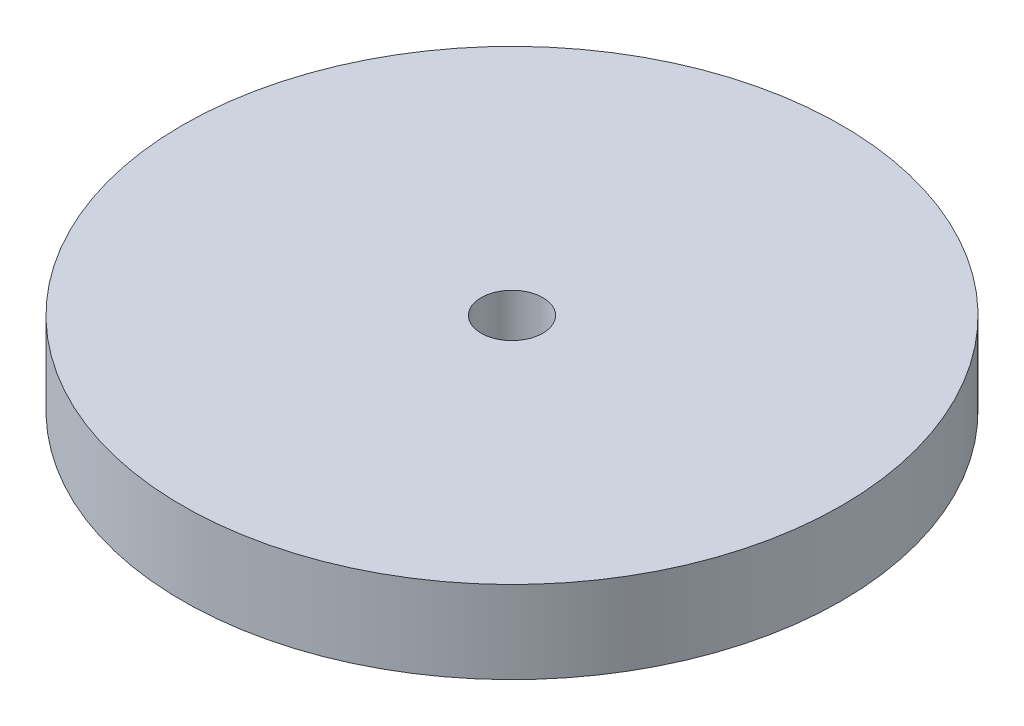
from build123d import *

# Parameters (mm, degrees)
SKETCH3_W           = 76.2
SKETCH3_H           = 9.525
BOSS_EXTRUDE1_DEPTH = 76.2
SKETCH4_R           = 3.5687
CUT_EXTRUDE2_DEPTH  = 86.725
CUT_EXTRUDE4_DEPTH  = 12.7
CUT_EXTRUDE6_DEPTH  = 12.7
CUT_EXTRUDE9_DEPTH  = 12.7
CUT_EXTRUDE10_DEPTH = 12.7


with BuildPart() as part:
    # Sketch3 → Boss-Extrude1 (new body)
    with BuildSketch(Plane.XY):
        Rectangle(SKETCH3_W, SKETCH3_H)
    extrude(amount=BOSS_EXTRUDE1_DEPTH)

    # Sketch4 → Cut-Extrude2 (cut, through all)
    with BuildSketch(Plane(origin=(0, 4.7625, 0), x_dir=(1, 0, 0), z_dir=(0, 1, 0))):
        with Locations(Location((0, -38.1, 0), (0, 0, 180))):
            Circle(SKETCH4_R)
    extrude(amount=-CUT_EXTRUDE2_DEPTH, mode=Mode.SUBTRACT)

    # Sketch5 → Cut-Extrude4 (cut)
    with BuildSketch(Plane(origin=(0, 4.7625, 0), x_dir=(1, 0, 0), z_dir=(0, 1, 0))):
        with BuildLine():
            Line((-38.1, -38.1), (-38.1, 0))
            Line((-38.1, 0), (0, 0))
            ThreePointArc((0, 0), (-26.940768363, -11.159231637), (-38.1, -38.1))
        make_face()
    extrude(amount=-CUT_EXTRUDE4_DEPTH, mode=Mode.SUBTRACT)

    # Sketch7 → Cut-Extrude6 (cut)
    with BuildSketch(Plane(origin=(0, 4.7625, 0), x_dir=(1, 0, 0), z_dir=(0, 1, 0))):
        with BuildLine():
            Line((0, 0), (38.1, 0))
            Line((38.1, 0), (38.1, -38.1))
            ThreePointArc((38.1, -38.1), (26.940768363, -11.159231637), (0, 0))
        make_face()
    extrude(amount=-CUT_EXTRUDE6_DEPTH, mode=Mode.SUBTRACT)

    # Sketch8 → Cut-Extrude9 (cut)
    with BuildSketch(Plane(origin=(0, 4.7625, 0), x_dir=(1, 0, 0), z_dir=(0, 1, 0))):
        with BuildLine():
            Line((38.1, -76.2), (38.1, -38.1))
            ThreePointArc((38.1, -38.1), (26.940768363, -65.040768363), (0, -76.2))
            Line((0, -76.2), (38.1, -76.2))
        make_face()
    extrude(amount=-CUT_EXTRUDE9_DEPTH, mode=Mode.SUBTRACT)

    # Sketch9 → Cut-Extrude10 (cut)
    with BuildSketch(Plane(origin=(0, 4.7625, 0), x_dir=(1, 0, 0), z_dir=(0, 1, 0))):
        with BuildLine():
            Line((0, -76.2), (-38.1, -76.2))
            Line((-38.1, -76.2), (-38.1, -38.1))
            ThreePointArc((-38.1, -38.1), (-26.940768363, -65.040768363), (0, -76.2))
        make_face()
    extrude(amount=-CUT_EXTRUDE10_DEPTH, mode=Mode.SUBTRACT)


solid = part.part
